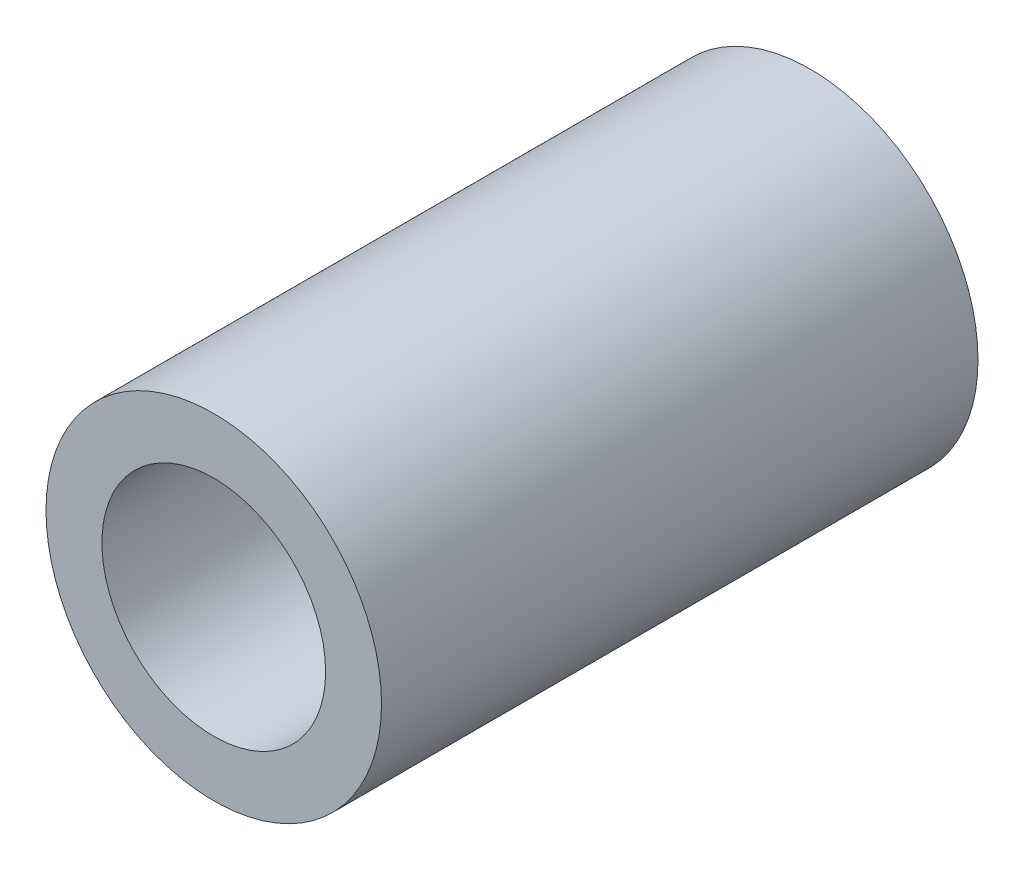
from build123d import *

# Parameters (mm, degrees)
SKETCH1_R           = 4.5
SKETCH1_R_2         = 3
BOSS_EXTRUDE1_DEPTH = 16


with BuildPart() as part:
    # Sketch1 → Boss-Extrude1 (new body)
    with BuildSketch(Plane.XY):
        Circle(SKETCH1_R)
        Circle(SKETCH1_R_2, mode=Mode.SUBTRACT)
    extrude(amount=BOSS_EXTRUDE1_DEPTH)


solid = part.part
